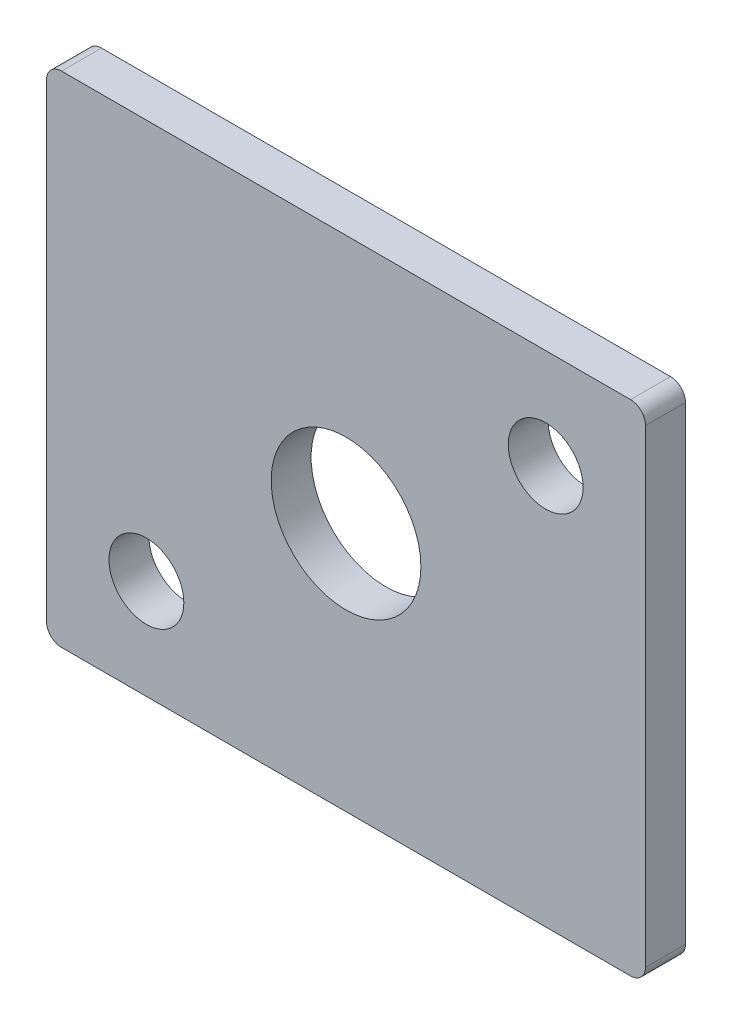
from build123d import *

# Parameters (mm, degrees)
SKIZZE1_W                       = 12
SKIZZE1_H                       = 10
AUFSATZ_LINEAR_AUSTRAGEN1_DEPTH = 0.8
SKIZZE2_R                       = 0.75
SKIZZE2_R_2                     = 1.5
SCHNITT_LINEAR_AUSTRAGEN1_DEPTH = 16.640971837
VERRUNDUNG1_R                   = 0.3


with BuildPart() as part:
    # Skizze1 → Aufsatz-Linear austragen1 (new body)
    with BuildSketch(Plane.XY):
        with Locations((6, 5)):
            Rectangle(SKIZZE1_W, SKIZZE1_H)
    extrude(amount=AUFSATZ_LINEAR_AUSTRAGEN1_DEPTH)

    # Skizze2 → Schnitt-Linear austragen1 (cut, through all)
    with BuildSketch(Plane.XY.offset(0.8)):
        with Locations((2, 2)):
            Circle(SKIZZE2_R)
        with Locations((6, 5)):
            Circle(SKIZZE2_R_2)
        with Locations((10, 8)):
            Circle(SKIZZE2_R)
    extrude(amount=-SCHNITT_LINEAR_AUSTRAGEN1_DEPTH, mode=Mode.SUBTRACT)

    # Verrundung1
    verrundung1_edges = [part.edges().sort_by_distance(p)[0] for p in [
        (0, 10, 0.4),
        (12, 10, 0.4),
        (12, 0, 0.4),
        (0, 0, 0.4),
    ]]
    fillet(verrundung1_edges, radius=VERRUNDUNG1_R)


solid = part.part
